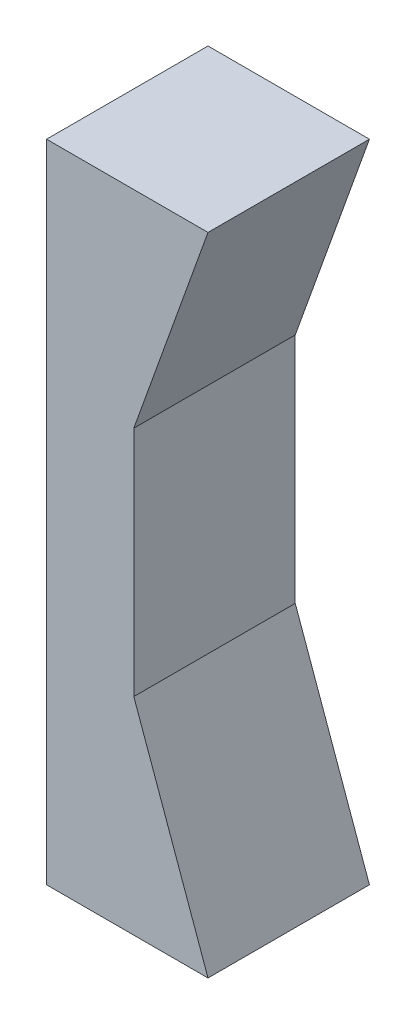
from build123d import *

# Parameters (mm, degrees)
SKETCH1_W           = 1000
SKETCH1_H           = 250
BOSS_EXTRUDE1_DEPTH = 250
CUT_EXTRUDE1_DEPTH  = 573.821961869
SHELL1_T            = -1


with BuildPart() as part:
    # Sketch1 → Boss-Extrude1 (new body)
    with BuildSketch(Plane(origin=(0, 0, 0), x_dir=(0, 1, 0), z_dir=(0, 0, 1))):
        Rectangle(SKETCH1_W, SKETCH1_H)
    extrude(amount=BOSS_EXTRUDE1_DEPTH)

    # Sketch2 → Cut-Extrude1 (cut, through all)
    with BuildSketch(Plane(origin=(0, 0, 250), x_dir=(0, -1, 0), z_dir=(0, 0, 1))):
        Polygon((-500, 125), (-180, 10.108747069), (180, 10.108747069), (500, 125), align=None)
    extrude(amount=-CUT_EXTRUDE1_DEPTH, mode=Mode.SUBTRACT)

    # Shell1
    shell1_openings = [part.faces().sort_by_distance(p)[0] for p in [
        (-34.803159923, 0, 0),
    ]]
    offset(amount=SHELL1_T, openings=shell1_openings, kind=Kind.INTERSECTION)


solid = part.part
